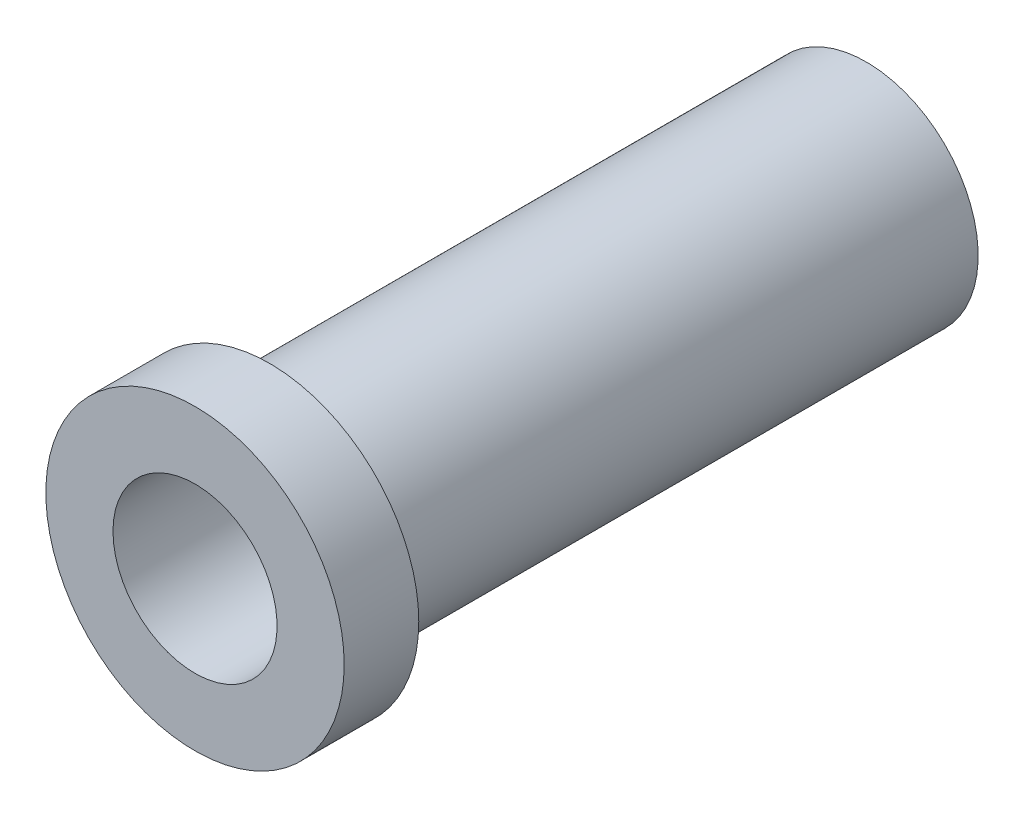
from build123d import *

# Parameters (mm, degrees)
SKETCH2_R           = 10
BOSS_EXTRUDE1_DEPTH = 5
SKETCH3_R           = 7.5
BOSS_EXTRUDE2_DEPTH = 40
SKETCH4_R           = 5.5
CUT_EXTRUDE1_DEPTH  = 48.16990566


with BuildPart() as part:
    # Sketch2 → Boss-Extrude1 (new body)
    with BuildSketch(Plane.XY):
        Circle(SKETCH2_R)
    extrude(amount=BOSS_EXTRUDE1_DEPTH)

    # Sketch3 → Boss-Extrude2 (add)
    with BuildSketch(Plane(origin=(0, 0, 0), x_dir=(-1, 0, 0), z_dir=(0, 0, -1))):
        Circle(SKETCH3_R)
    extrude(amount=BOSS_EXTRUDE2_DEPTH)

    # Sketch4 → Cut-Extrude1 (cut, through all)
    with BuildSketch(Plane(origin=(0, 0, -40), x_dir=(-1, 0, 0), z_dir=(0, 0, -1))):
        Circle(SKETCH4_R)
    extrude(amount=-CUT_EXTRUDE1_DEPTH, mode=Mode.SUBTRACT)


solid = part.part
